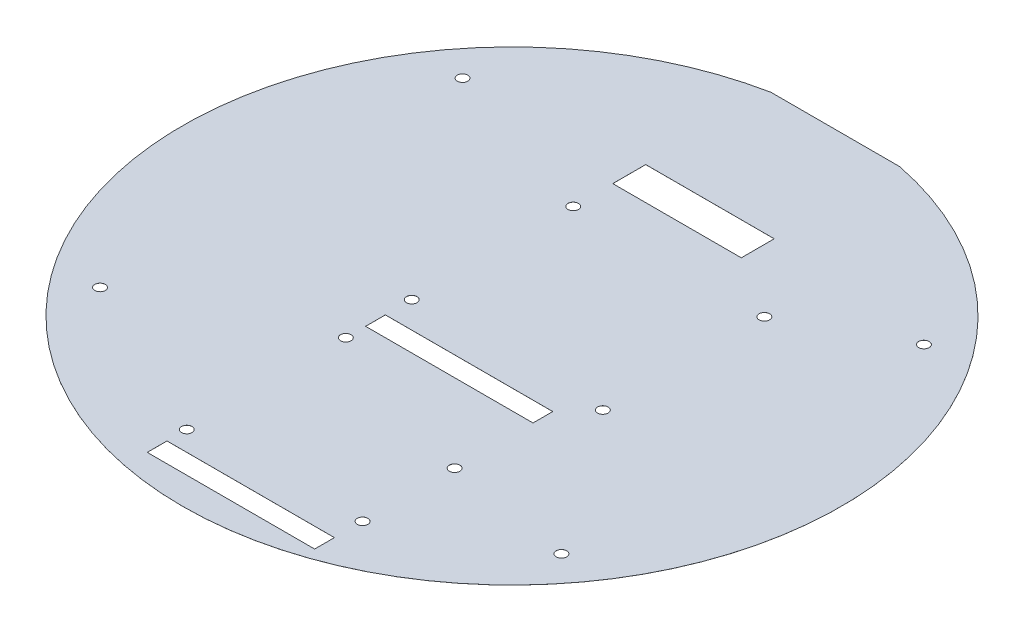
from build123d import *

# Parameters (mm, degrees)
SKETCH_2_R      = 1.6
SKETCH_2_W      = 39
SKETCH_2_H      = 10
SKETCH_2_W_2    = 50.8
SKETCH_2_H_2    = 6
EXTRUDE_1_DEPTH = 0.01


with BuildPart() as part:
    # 草圖2 → 填料-伸長1 (new body)
    with BuildSketch(Plane(origin=(0, 0, 0), x_dir=(1, 0, 0), z_dir=(0, 1, 0))):
        with BuildLine():
            Line((-19.5, 98.080324225), (19.5, 98.080324225))
            ThreePointArc((19.5, 98.080324225), (0, -100), (-19.5, 98.080324225))
        make_face()
        with Locations((-19.5, 38.080324225)):
            Circle(SKETCH_2_R, mode=Mode.SUBTRACT)
        with Locations((-19.5, -10.919675775)):
            Circle(SKETCH_2_R, mode=Mode.SUBTRACT)
        with Locations((38.5, 38.080324225)):
            Circle(SKETCH_2_R, mode=Mode.SUBTRACT)
        with Locations((38.5, -10.919675775)):
            Circle(SKETCH_2_R, mode=Mode.SUBTRACT)
        with Locations((-19.5, -30.919675775)):
            Circle(SKETCH_2_R, mode=Mode.SUBTRACT)
        with Locations((-19.5, -79.179675775)):
            Circle(SKETCH_2_R, mode=Mode.SUBTRACT)
        with Locations((31.3, -48.699675775)):
            Circle(SKETCH_2_R, mode=Mode.SUBTRACT)
        with Locations((31.3, -76.639675775)):
            Circle(SKETCH_2_R, mode=Mode.SUBTRACT)
        with Locations((-70, -55)):
            Circle(SKETCH_2_R, mode=Mode.SUBTRACT)
        with Locations((-70, 55)):
            Circle(SKETCH_2_R, mode=Mode.SUBTRACT)
        with Locations((70, -55)):
            Circle(SKETCH_2_R, mode=Mode.SUBTRACT)
        with Locations((70, 55)):
            Circle(SKETCH_2_R, mode=Mode.SUBTRACT)
        with Locations((0, 55.080324225)):
            Rectangle(SKETCH_2_W, SKETCH_2_H, mode=Mode.SUBTRACT)
        with Locations((5.9, -21.919675775)):
            Rectangle(SKETCH_2_W_2, SKETCH_2_H_2, mode=Mode.SUBTRACT)
        with Locations((5.9, -88.179675775)):
            Rectangle(SKETCH_2_W_2, SKETCH_2_H_2, mode=Mode.SUBTRACT)
    extrude(amount=EXTRUDE_1_DEPTH)


solid = part.part
